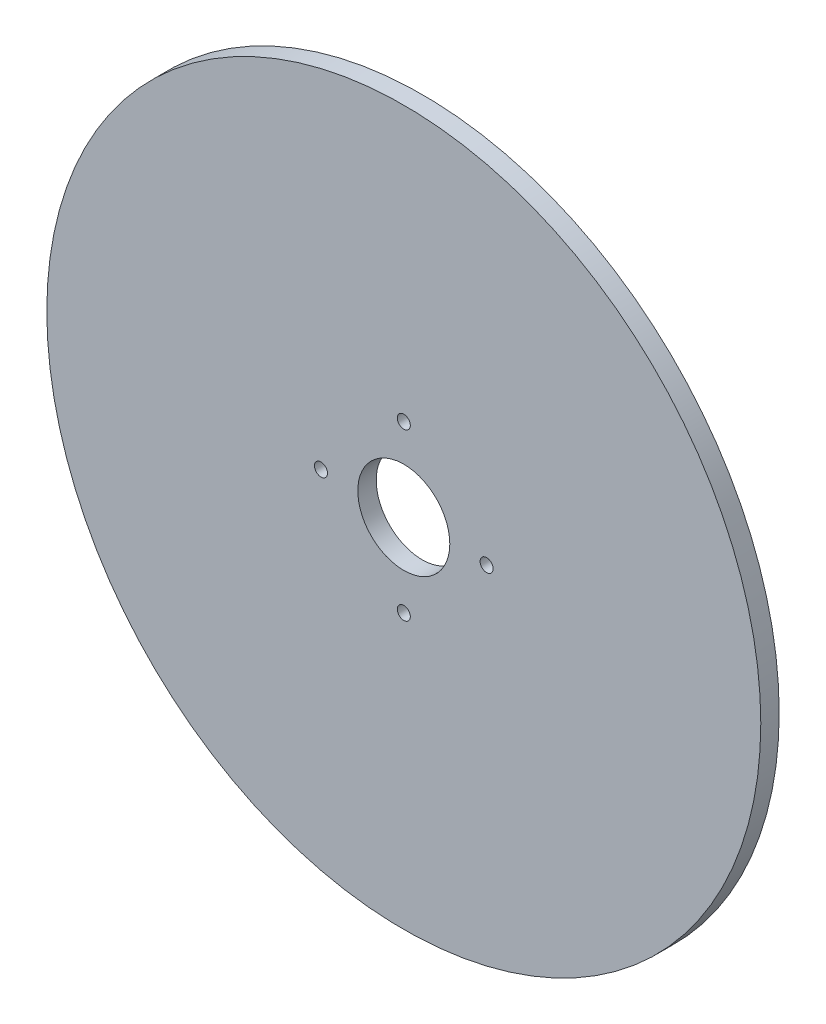
from build123d import *

# Parameters (mm, degrees)
SKETCH1_R           = 123.19
SKETCH1_R_2         = 15.875
SKETCH1_R_3         = 2.25
BOSS_EXTRUDE1_DEPTH = 6.35


with BuildPart() as part:
    # Sketch1 → Boss-Extrude1 (new body)
    with BuildSketch(Plane.XY):
        Circle(SKETCH1_R)
        Circle(SKETCH1_R_2, mode=Mode.SUBTRACT)
        with Locations((0, 28.575)):
            Circle(SKETCH1_R_3, mode=Mode.SUBTRACT)
        with Locations((-28.575, 0)):
            Circle(SKETCH1_R_3, mode=Mode.SUBTRACT)
        with Locations((28.575, 0)):
            Circle(SKETCH1_R_3, mode=Mode.SUBTRACT)
        with Locations((0, -28.575)):
            Circle(SKETCH1_R_3, mode=Mode.SUBTRACT)
    extrude(amount=BOSS_EXTRUDE1_DEPTH)


solid = part.part
